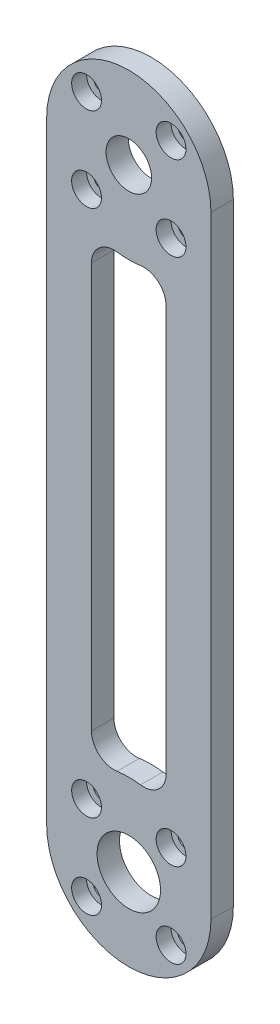
from build123d import *

# Parameters (mm, degrees)
BOSS_EXTRUDE1_DEPTH = 3
SKETCH3_R           = 4.25
SKETCH3_R_2         = 1.1
CUT_EXTRUDE3_DEPTH  = 3
SKETCH3_6_R         = 2
CUT_EXTRUDE4_DEPTH  = 2
CIRPATTERN3_COUNT   = 4
SKETCH2_R           = 3.05
SKETCH2_R_2         = 1
CUT_EXTRUDE5_DEPTH  = 3
SKETCH2_5_R         = 2
CUT_EXTRUDE6_DEPTH  = 2
CIRPATTERN4_COUNT   = 4
FILLET1_R           = 3


with BuildPart() as part:
    # Sketch1 → Boss-Extrude1 (new body)
    with BuildSketch(Plane.XY):
        with BuildLine():
            ThreePointArc((11, 41), (0, 52), (-11, 41))
            Line((-11, 41), (-11, -41))
            ThreePointArc((-11, -41), (0, -52), (11, -41))
            Line((11, -41), (11, 41))
        make_face()
        with BuildLine():
            ThreePointArc((0, 30), (2.571230378, 30.304731217), (5, 31.202041029))
            Line((5, 31.202041029), (5, -31.202041029))
            ThreePointArc((5, -31.202041029), (2.571230378, -30.304731217), (0, -30))
            ThreePointArc((0, -30), (-2.571230378, -30.304731217), (-5, -31.202041029))
            Line((-5, -31.202041029), (-5, 31.202041029))
            ThreePointArc((-5, 31.202041029), (-2.571230378, 30.304731217), (0, 30))
        make_face(mode=Mode.SUBTRACT)
    extrude(amount=BOSS_EXTRUDE1_DEPTH)

    # Sketch3 → Cut-Extrude3 (cut)
    with BuildSketch(Plane.XY.offset(3)):
        with Locations((0, -41)):
            Circle(SKETCH3_R)
        with Locations((5.656854249, -35.343145751)):
            Circle(SKETCH3_R_2)
    cut_extrude3 = extrude(amount=-CUT_EXTRUDE3_DEPTH, mode=Mode.SUBTRACT)

    # Sketch3<6> → Cut-Extrude4 (cut)
    with BuildSketch(Plane.XY.offset(3)):
        with Locations((5.656854249, -35.343145751)):
            Circle(SKETCH3_6_R)
    cut_extrude4 = extrude(amount=-CUT_EXTRUDE4_DEPTH, mode=Mode.SUBTRACT)

    # CirPattern3: Cut-Extrude3, Cut-Extrude4 ×4 about axis
    cirpattern3_axis = Axis((0, -41, 0), (0, 0, 1))
    add([cut_extrude3.rotate(cirpattern3_axis, i * 360 / CIRPATTERN3_COUNT) for i in range(1, CIRPATTERN3_COUNT)], mode=Mode.SUBTRACT)
    add([cut_extrude4.rotate(cirpattern3_axis, i * 360 / CIRPATTERN3_COUNT) for i in range(1, CIRPATTERN3_COUNT)], mode=Mode.SUBTRACT)

    # Sketch2 → Cut-Extrude5 (cut)
    with BuildSketch(Plane.XY.offset(3)):
        with Locations((0, 41)):
            Circle(SKETCH2_R)
        with Locations((5.656854249, 46.656854249)):
            Circle(SKETCH2_R_2)
    cut_extrude5 = extrude(amount=-CUT_EXTRUDE5_DEPTH, mode=Mode.SUBTRACT)

    # Sketch2<5> → Cut-Extrude6 (cut)
    with BuildSketch(Plane.XY.offset(3)):
        with Locations((5.656854249, 46.656854249)):
            Circle(SKETCH2_5_R)
    cut_extrude6 = extrude(amount=-CUT_EXTRUDE6_DEPTH, mode=Mode.SUBTRACT)

    # CirPattern4: Cut-Extrude5, Cut-Extrude6 ×4 about axis
    cirpattern4_axis = Axis((0, 41, 0), (0, 0, 1))
    add([cut_extrude5.rotate(cirpattern4_axis, i * 360 / CIRPATTERN4_COUNT) for i in range(1, CIRPATTERN4_COUNT)], mode=Mode.SUBTRACT)
    add([cut_extrude6.rotate(cirpattern4_axis, i * 360 / CIRPATTERN4_COUNT) for i in range(1, CIRPATTERN4_COUNT)], mode=Mode.SUBTRACT)

    # Fillet1
    fillet1_edges = [part.edges().sort_by_distance(p)[0] for p in [
        (5, 31.202041029, 1.5),
        (-5, 31.202041029, 1.5),
        (-5, -31.202041029, 1.5),
        (5, -31.202041029, 1.5),
    ]]
    fillet(fillet1_edges, radius=FILLET1_R)


solid = part.part
